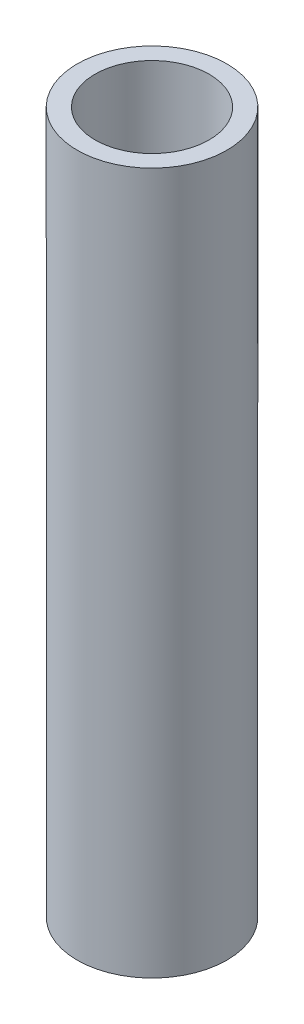
from build123d import *

# Parameters (mm, degrees)
SKETCH1_R           = 1.05
SKETCH1_R_2         = 0.8
BOSS_EXTRUDE1_DEPTH = 9.841037076


with BuildPart() as part:
    # Sketch1 → Boss-Extrude1 (new body)
    with BuildSketch(Plane(origin=(0, 0, 0), x_dir=(1, 0, 0), z_dir=(0, 1, 0))):
        with Locations(Location((0, 0, 0), (0, 0, 90))):
            Circle(SKETCH1_R)
        with Locations(Location((0, 0, 0), (0, 0, 90))):
            Circle(SKETCH1_R_2, mode=Mode.SUBTRACT)
    extrude(amount=BOSS_EXTRUDE1_DEPTH)


solid = part.part
